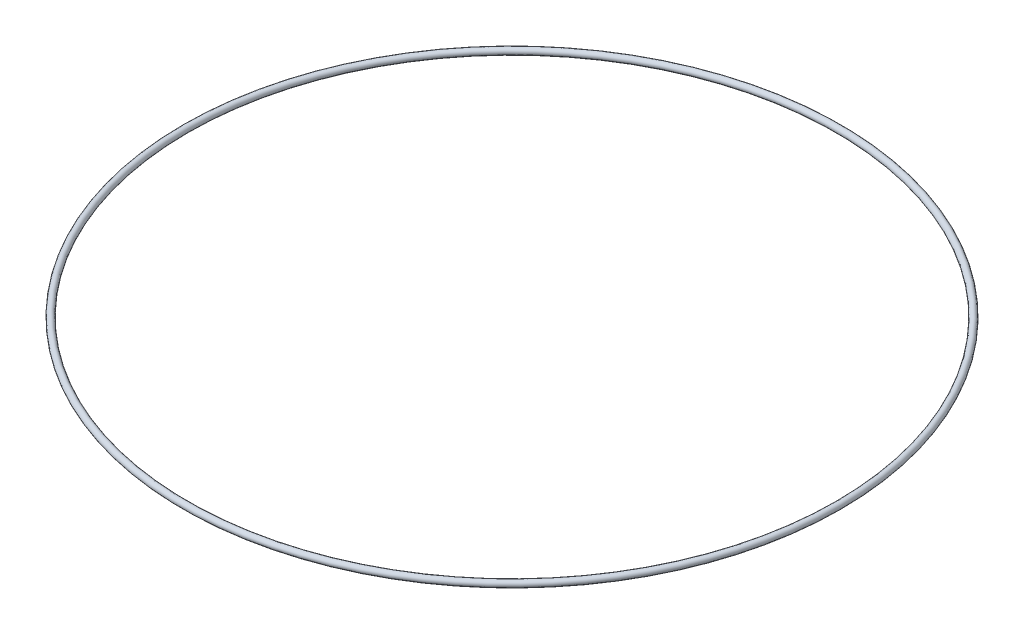
from build123d import *

# Parameters (mm, degrees)
SKETCH2_R = 1.27


with BuildPart() as part:
    # Sweep1: sweep along a path in Sketch1
    with BuildLine(Plane(origin=(0, 0, 0), x_dir=(1, 0, 0), z_dir=(0, 1, 0))) as sweep1_path:
        CenterArc((0, 0), 127, 0, 360)
    # Sketch2 → Sweep1 (sweep)
    with BuildSketch(Plane.XY):
        with Locations((-127, 0)):
            Circle(SKETCH2_R)
    sweep(path=sweep1_path.line)


solid = part.part
